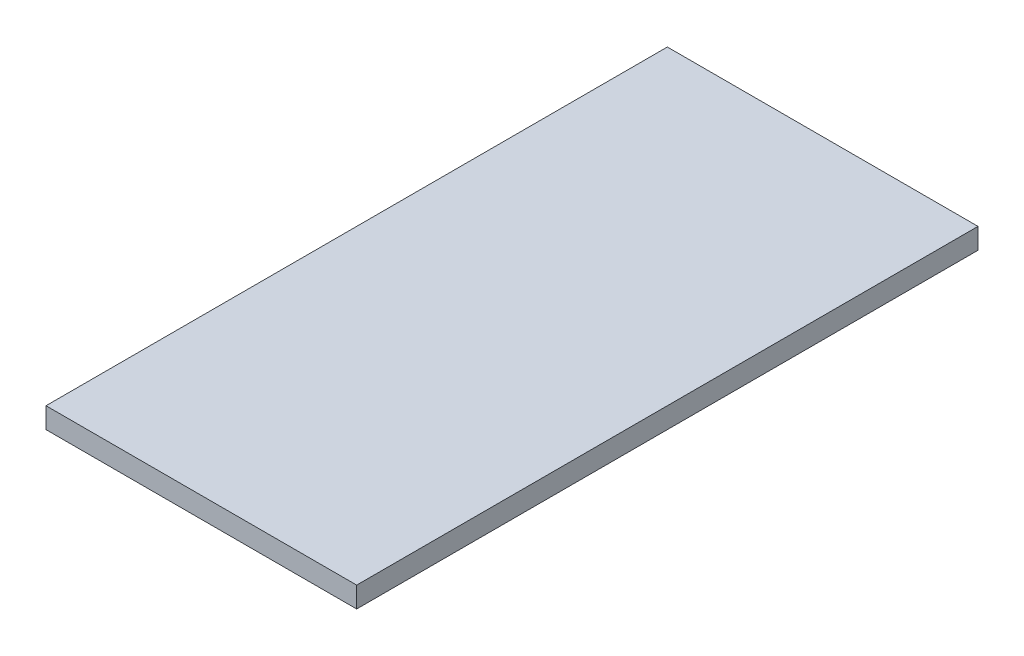
from build123d import *

# Parameters (mm, degrees)
BASE_SKETCH_W       = 150
BASE_SKETCH_H       = 300
BOSS_EXTRUDE1_DEPTH = 10


with BuildPart() as part:
    # Base Sketch → Boss-Extrude1 (new body)
    with BuildSketch(Plane(origin=(0, 0, 0), x_dir=(1, 0, 0), z_dir=(0, 1, 0))):
        Rectangle(BASE_SKETCH_W, BASE_SKETCH_H)
    extrude(amount=BOSS_EXTRUDE1_DEPTH)


solid = part.part
